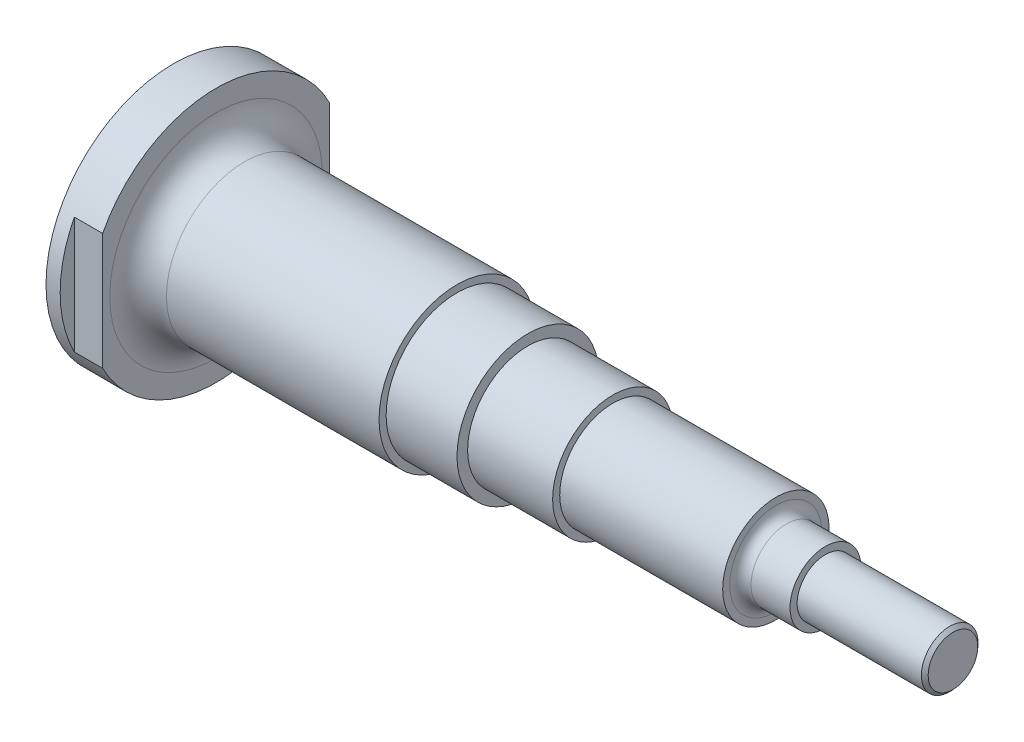
from build123d import *

# Parameters (mm, degrees)
ESQUISSE3_W             = 4
ESQUISSE3_H             = 20
ENL_V_MAT_EXTRU_1_DEPTH = 4


with BuildPart() as part:
    # Esquisse1 → Base-Révolution (revolve)
    with BuildSketch(Plane.XY, mode=Mode.PRIVATE) as base_r_volution_sk:
        with BuildLine():
            Line((-130, 7), (-130, 18))
            Line((-130, 18), (-124, 18))
            Line((-124, 18), (-124, 15))
            ThreePointArc((-124, 15), (-122.828427125, 12.171572875), (-120, 11))
            Line((-120, 11), (-90, 11))
            Line((-90, 11), (-90, 10))
            Line((-90, 10), (-80, 10))
            Line((-80, 10), (-80, 8.5))
            Line((-80, 8.5), (-68, 8.5))
            Line((-68, 8.5), (-68, 7.5))
            Line((-68, 7.5), (-45, 7.5))
            Line((-45, 7.5), (-45, 6.5))
            ThreePointArc((-45, 6.5), (-44.560660172, 5.439339828), (-43.5, 5))
            Line((-43.5, 5), (-38, 5))
            Line((-38, 5), (-38, 4))
            Line((-38, 4), (-20.461275116, 4))
            Line((-20.461275116, 4), (-20, 3.5))
            Line((-20, 3.5), (-20, 0))
            Line((-20, 0), (-92.003246889, 0))
            Line((-92.003246889, 0), (-95.003246889, 5))
            Line((-95.003246889, 5), (-101.003246889, 5))
            Line((-101.003246889, 5), (-101.003246889, 6))
            Line((-101.003246889, 6), (-129.003246889, 6))
            Line((-129.003246889, 6), (-129.003246889, 7))
            Line((-129.003246889, 7), (-130, 7))
        make_face()
    revolve(base_r_volution_sk.sketch.rotate(Axis((-125, 0, 0), (1, 0, 0)), 90), axis=Axis((-125, 0, 0), (1, 0, 0)))

    # Esquisse3 → Enlèv. mat.-Extru.1 (cut)
    with BuildSketch(Plane(origin=(-124, 0, 0), x_dir=(0, 0, -1), z_dir=(1, 0, 0))):
        with Locations((-18, 0)):
            Rectangle(ESQUISSE3_W, ESQUISSE3_H)
        with Locations((18, 0)):
            Rectangle(ESQUISSE3_W, ESQUISSE3_H)
    extrude(amount=-ENL_V_MAT_EXTRU_1_DEPTH, mode=Mode.SUBTRACT)


solid = part.part
